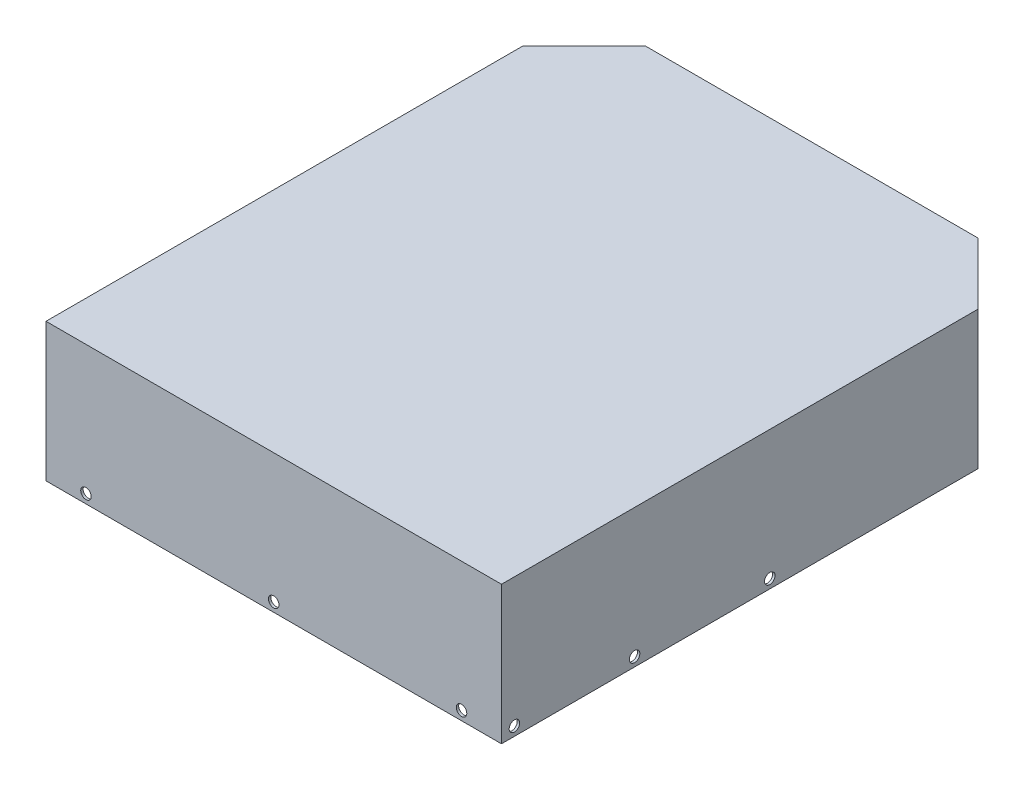
from build123d import *

# Parameters (mm, degrees)
SKETCH1_W                    = 303.2
SKETCH1_H                    = 358.2
BOSS_EXTRUDE1_DEPTH          = 92
CHAMFER1_SIZE                = 41
SHELL1_T                     = -1.6
F_7_0_7_DIAMETER_HOLE1_D     = 7
F_7_0_7_DIAMETER_HOLE1_DEPTH = 1.6
F_7_0_7_DIAMETER_HOLE2_D     = 7


with BuildPart() as part:
    # Sketch1 → Boss-Extrude1 (new body)
    with BuildSketch(Plane(origin=(0, 0, 0), x_dir=(1, 0, 0), z_dir=(0, 1, 0))):
        with Locations((0, 179.1)):
            Rectangle(SKETCH1_W, SKETCH1_H)
    extrude(amount=BOSS_EXTRUDE1_DEPTH)

    # Chamfer1
    chamfer1_edges = [part.edges().sort_by_distance(p)[0] for p in [
        (-151.6, 46, -358.2),
        (151.6, 46, -358.2),
    ]]
    chamfer(chamfer1_edges, length=CHAMFER1_SIZE)

    # Shell1
    shell1_openings = [part.faces().sort_by_distance(p)[0] for p in [
        (0, 0, -176.499178778),
    ]]
    offset(amount=SHELL1_T, openings=shell1_openings, kind=Kind.INTERSECTION)

    # Ø7.0 (7) Diameter Hole1
    with Locations(Plane.XY):
        with Locations((-125, 6), (0, 6), (125, 6)):
            Hole(F_7_0_7_DIAMETER_HOLE1_D / 2, depth=F_7_0_7_DIAMETER_HOLE1_DEPTH)

    # Ø7.0 (7) Diameter Hole2 (through all)
    with Locations(Plane.ZY.offset(151.6)):
        with Locations((-8.6, 6), (-88.6, 6), (-178.6, 6)):
            Hole(F_7_0_7_DIAMETER_HOLE2_D / 2)


solid = part.part
